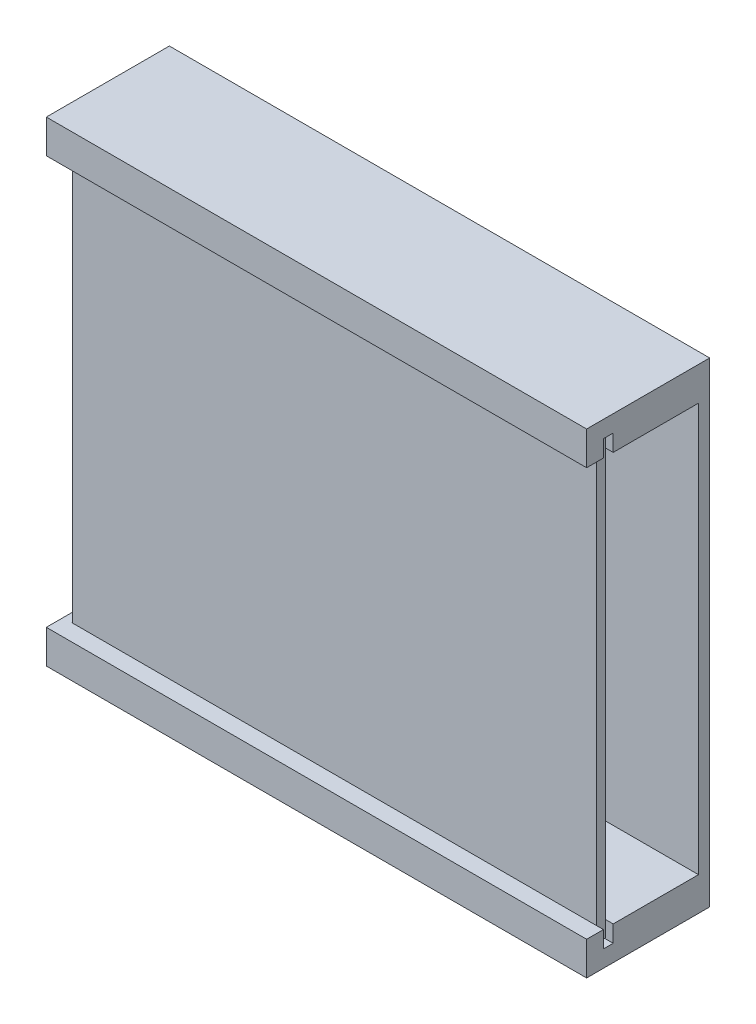
from build123d import *

# Parameters (mm, degrees)
SKETCH4_W             = 93.726
SKETCH4_H             = 78.486
BOSS_EXTRUDE1_DEPTH   = 1.6
BOSS_EXTRUDE2_DEPTH   = 95
BOSS_EXTRUDE2_2_DEPTH = 95
SKETCH6_W             = 20
SKETCH6_H             = 6
BOSS_EXTRUDE3_DEPTH   = 1.6
SKETCH7_W             = 96.6
SKETCH7_H             = 85.004960342
SKETCH7_W_2           = 65.419983822
SKETCH7_H_2           = 73.004960342
BOSS_EXTRUDE4_DEPTH   = 2


with BuildPart() as part:
    # Sketch4 → Boss-Extrude1 (new body)
    with BuildSketch(Plane.XY):
        with Locations((82.55, 77.343)):
            Rectangle(SKETCH4_W, SKETCH4_H)
    extrude(amount=BOSS_EXTRUDE1_DEPTH)


with BuildPart() as body_2:
    # Sketch5 → Boss-Extrude2 (new body)
    with BuildSketch(Plane.ZY.offset(-35.687)):
        Polygon((-0.075, 113.845480171), (-15.325, 113.845480171), (-15.325, 119.845480171), (4.675, 119.845480171), (4.675, 113.845480171), (1.675, 113.845480171), (1.675, 116.845480171), (-0.075, 116.845480171), align=None)
    extrude(amount=-BOSS_EXTRUDE2_DEPTH)

    # Sketch6 → Boss-Extrude3 (add)
    with BuildSketch(Plane.ZY.offset(-35.687)):
        with Locations((-5.325, 116.845480171)):
            Rectangle(SKETCH6_W, SKETCH6_H)
        with Locations((-5.325, 37.840519829)):
            Rectangle(SKETCH6_W, SKETCH6_H)
    extrude(amount=BOSS_EXTRUDE3_DEPTH)


with BuildPart() as body_3:
    # Sketch5 → Boss-Extrude2 2 (new body)
    with BuildSketch(Plane.ZY.offset(-35.687)):
        Polygon((-0.075, 37.840519829), (-0.075, 40.840519829), (-15.325, 40.840519829), (-15.325, 34.840519829), (4.675, 34.840519829), (4.675, 40.840519829), (1.675, 40.840519829), (1.675, 37.840519829), align=None)
    extrude(amount=-BOSS_EXTRUDE2_2_DEPTH)


with BuildPart() as boss_extrude3_piece_1:
    # of the separate pieces the step leaves, piece 1, a body of its own (boss_extrude3_pieces)
    add(body_2.part.solids().sort_by_distance((35.687, 113.845480171, -0.075))[0])

    # Sketch7 → Boss-Extrude4 (add)
    with BuildSketch(Plane(origin=(0, 0, -15.325), x_dir=(-1, 0, 0), z_dir=(0, 0, -1))):
        with Locations((-82.387, 77.343)):
            Rectangle(SKETCH7_W, SKETCH7_H)
        with Locations((-79.759359545, 77.343)):
            Rectangle(SKETCH7_W_2, SKETCH7_H_2, mode=Mode.SUBTRACT)
    extrude(amount=BOSS_EXTRUDE4_DEPTH)


with BuildPart() as boss_extrude3_piece_2:
    # of the separate pieces the step leaves, piece 2, a body of its own (boss_extrude3_pieces)
    add(body_2.part.solids().sort_by_distance((35.687, 34.840519829, 4.675))[0])


with BuildPart() as body_3_1:
    add(body_3.part)

    # Combine1: union Boss-Extrude3 piece 2, Boss-Extrude3 piece 1
    add(boss_extrude3_piece_2.part)
    add(boss_extrude3_piece_1.part)


solid = Compound([part.part, body_3_1.part])
